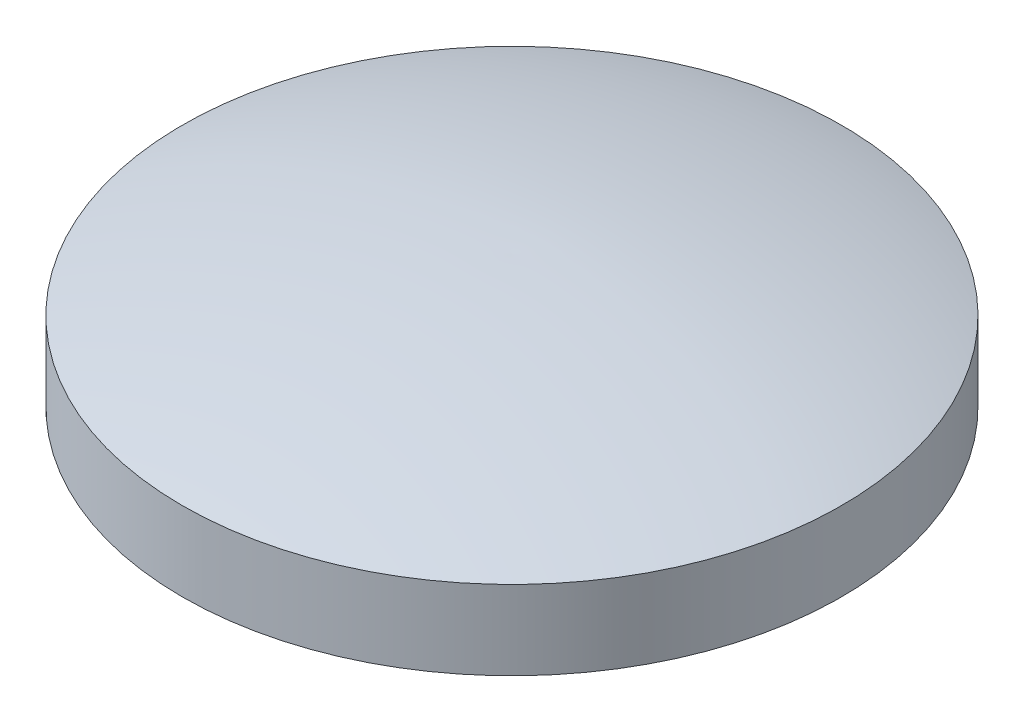
from build123d import *

# Parameters (mm, degrees)
SKETCH1_R           = 12.5
BOSS_EXTRUDE1_DEPTH = 3


with BuildPart() as part:
    # Sketch1 → Boss-Extrude1 (new body)
    with BuildSketch(Plane(origin=(0, 0, 0), x_dir=(1, 0, 0), z_dir=(0, 1, 0))):
        with Locations(Location((0, 0, 0), (0, 0, 270))):
            Circle(SKETCH1_R)
    extrude(amount=BOSS_EXTRUDE1_DEPTH)

    # Sketch2 → Revolve1 (revolve)
    with BuildSketch(Plane(origin=(0, 0, 0), x_dir=(0, 0, -1), z_dir=(1, 0, 0))):
        with BuildLine():
            Line((0, 3), (0, 5.027154564))
            add(Edge.make_bspline(
                [(-12.5, 3), (-9.265837711, 4.120269782), (-4.309145665, 5.082863575), (0, 5.027154564)],
                knots=[0, 0, 0, 0, 0.511836962, 0.511836962, 0.511836962, 0.511836962], degree=3))
            Line((-12.5, 3), (0, 3))
        make_face()
    revolve(axis=Axis((0, 3, 0), (0, 1, 0)))


solid = part.part
